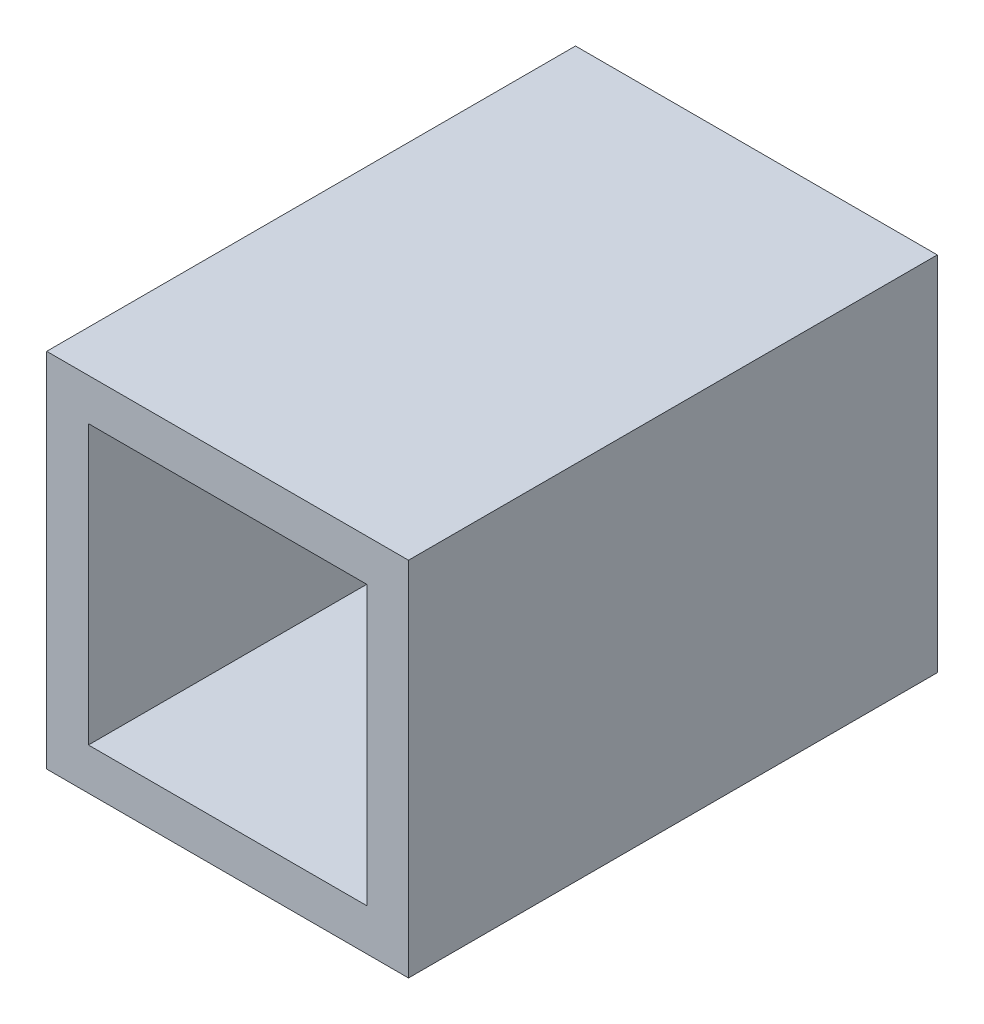
from build123d import *

# Parameters (mm, degrees)
SKETCH1_W           = 13
SKETCH1_H           = 13
SKETCH1_W_2         = 10
SKETCH1_H_2         = 10
BOSS_EXTRUDE1_DEPTH = 19


with BuildPart() as part:
    # Sketch1 → Boss-Extrude1 (new body)
    with BuildSketch(Plane.XY):
        Rectangle(SKETCH1_W, SKETCH1_H)
        Rectangle(SKETCH1_W_2, SKETCH1_H_2, mode=Mode.SUBTRACT)
    extrude(amount=BOSS_EXTRUDE1_DEPTH)


solid = part.part
